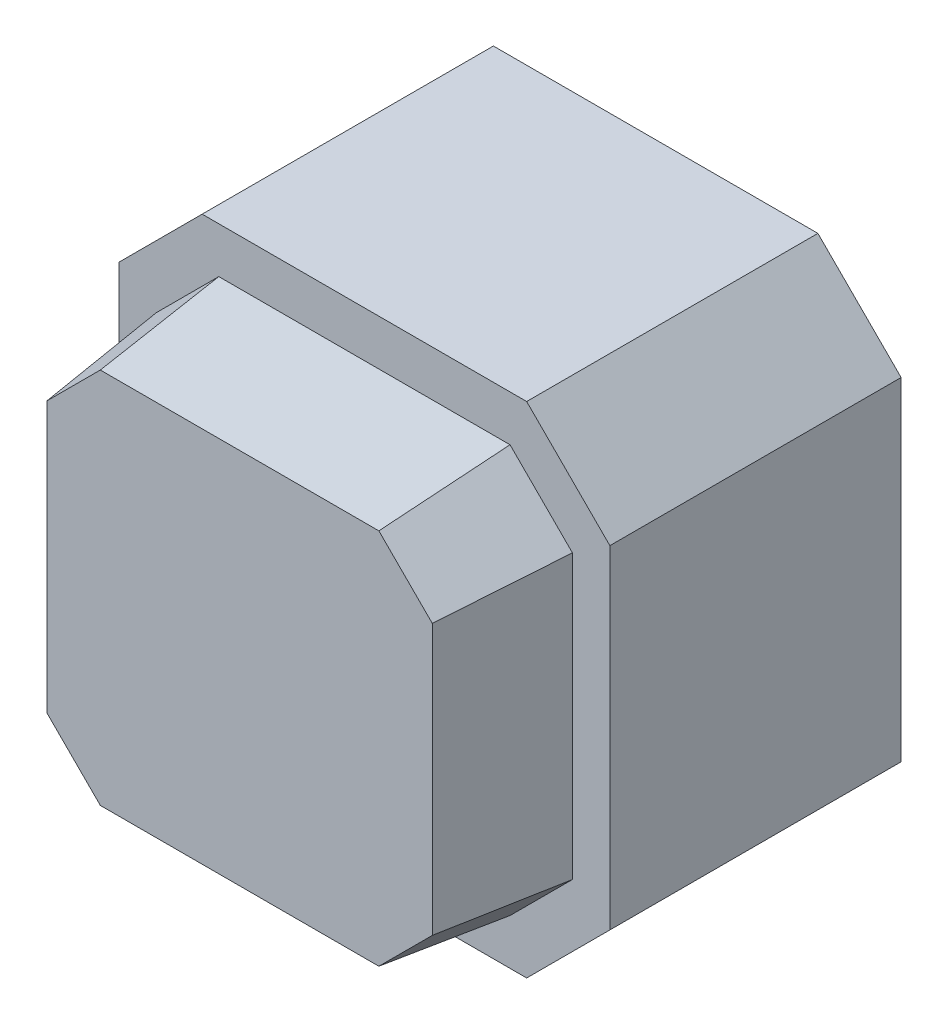
from build123d import *

# Parameters (mm, degrees)
BOSS_EXTRUDE1_DEPTH = 3.5
BOSS_EXTRUDE2_DEPTH = 1.5
BOSS_EXTRUDE2_TAPER = 7


with BuildPart() as part:
    # Sketch1 → Boss-Extrude1 (new body)
    with BuildSketch(Plane.XY):
        Polygon((-2.95, 2), (-1.95, 3), (1.95, 3), (2.95, 2), (2.95, -2), (1.95, -3), (-1.95, -3), (-2.95, -2), align=None)
    extrude(amount=BOSS_EXTRUDE1_DEPTH)

    # Sketch2 → Boss-Extrude2 (add)
    with BuildSketch(Plane.XY.offset(3.5)):
        Polygon((-2.5, 1.7), (-2.5, -1.7), (-1.75, -2.45), (1.75, -2.45), (2.5, -1.7), (2.5, 1.7), (1.75, 2.45), (-1.75, 2.45), align=None)
    extrude(amount=BOSS_EXTRUDE2_DEPTH, taper=BOSS_EXTRUDE2_TAPER)


solid = part.part
